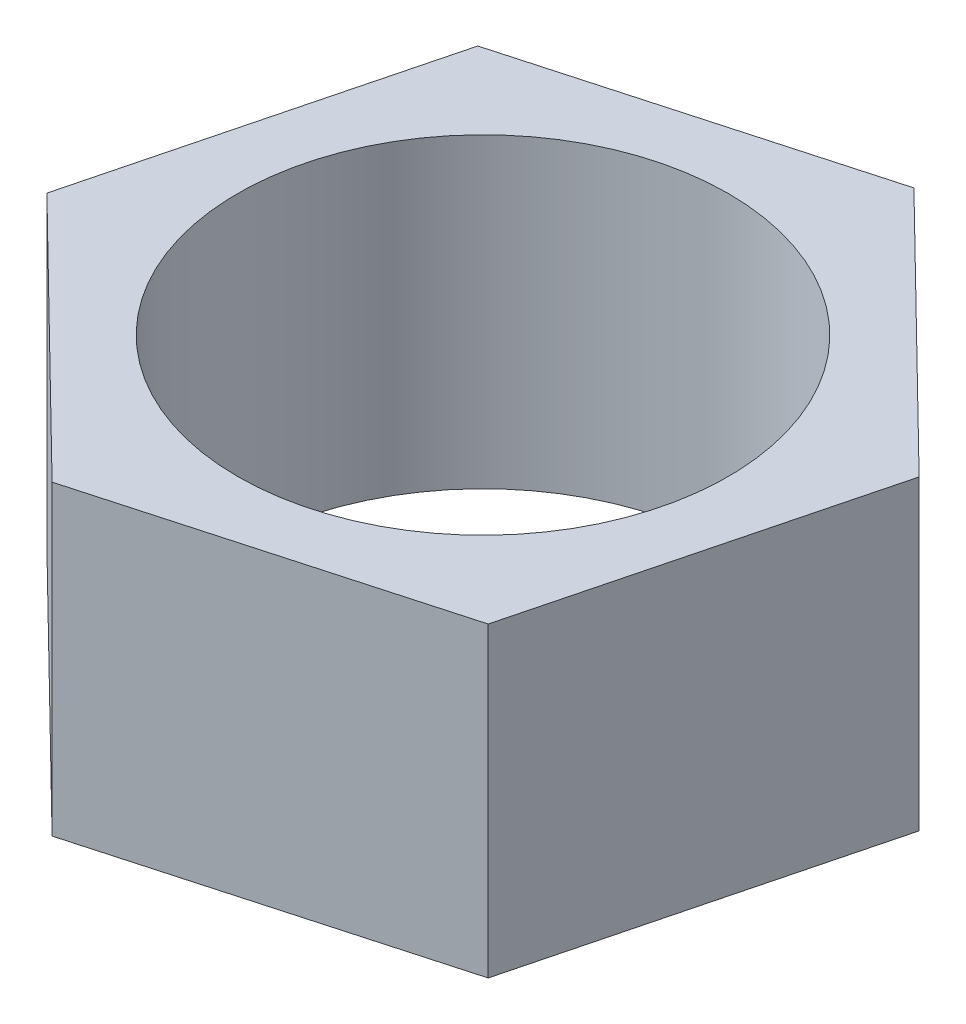
from build123d import *

# Parameters (mm, degrees)
SKETCH1_R           = 4
BOSS_EXTRUDE1_DEPTH = 5


with BuildPart() as part:
    # Sketch1 → Boss-Extrude1 (new body)
    with BuildSketch(Plane(origin=(0, 0, 0), x_dir=(1, 0, 0), z_dir=(0, 1, 0))):
        Polygon((4.12478499, -4.039737877), (5.560908121, 1.552299648), (1.436123131, 5.592037525), (-4.12478499, 4.039737877), (-5.560908121, -1.552299648), (-1.436123131, -5.592037525), align=None)
        with Locations(Location((0, 0, 0), (0, 0, 270))):
            Circle(SKETCH1_R, mode=Mode.SUBTRACT)
    extrude(amount=BOSS_EXTRUDE1_DEPTH)


solid = part.part
